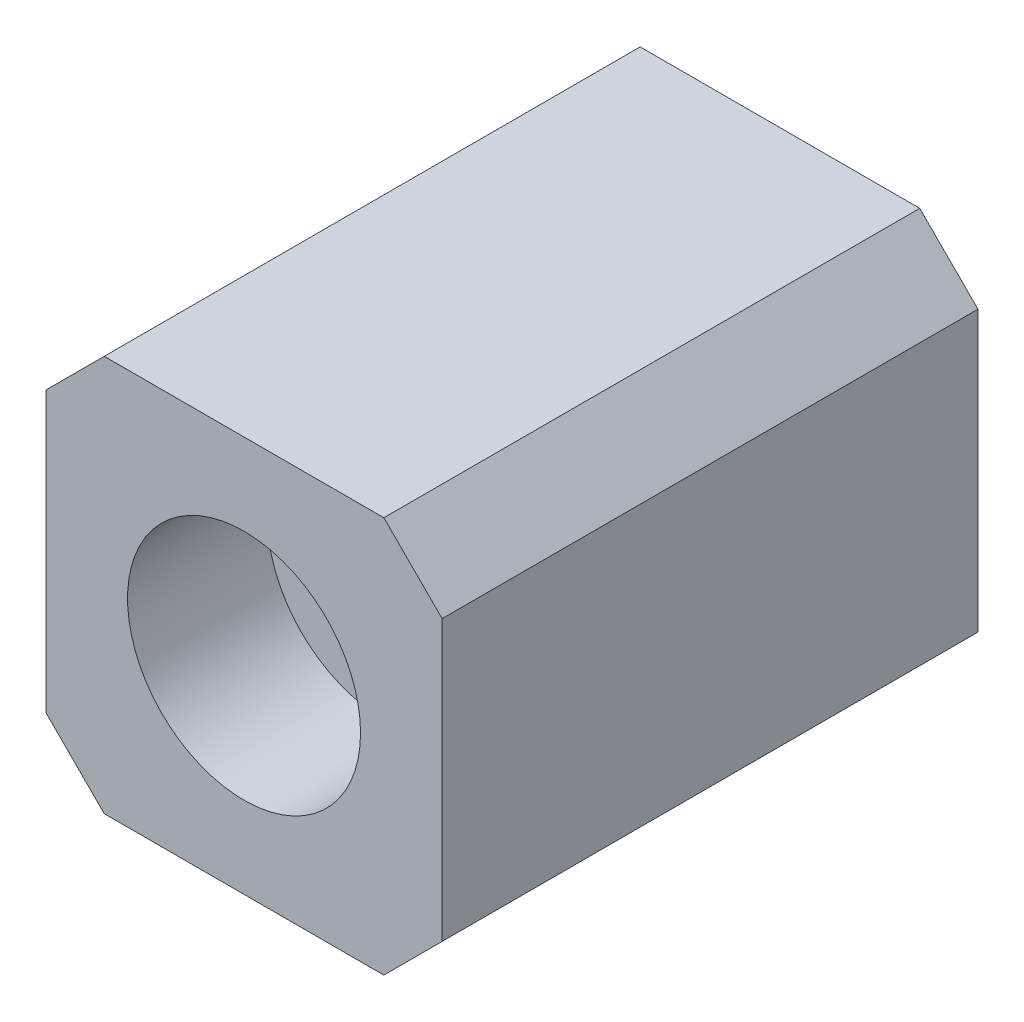
from build123d import *

# Parameters (mm, degrees)
SKETCH3_W           = 17
SKETCH3_H           = 17
BOSS_EXTRUDE1_DEPTH = 23
CUT_EXTRUDE1_DEPTH  = 34.271609519
SKETCH5_R           = 5
CUT_EXTRUDE2_DEPTH  = 6
CUT_EXTRUDE3_DEPTH  = 6


with BuildPart() as part:
    # Sketch3 → Boss-Extrude1 (new body)
    with BuildSketch(Plane.XY):
        with Locations((8.5, -8.5)):
            Rectangle(SKETCH3_W, SKETCH3_H)
    extrude(amount=BOSS_EXTRUDE1_DEPTH)

    # Sketch4 → Cut-Extrude1 (cut, through all)
    with BuildSketch(Plane.XY.offset(23)):
        Polygon((17, 0), (14.5, 0), (17, -2.5), align=None)
        Polygon((0, -2.5), (2.5, 0), (0, 0), align=None)
        Polygon((2.5, -17), (0, -14.5), (0, -17), align=None)
        Polygon((17, -17), (17, -14.5), (14.5, -17), align=None)
    extrude(amount=-CUT_EXTRUDE1_DEPTH, mode=Mode.SUBTRACT)

    # Sketch5 → Cut-Extrude2 (cut)
    with BuildSketch(Plane.XY.offset(23)):
        with Locations((8.5, -8.5)):
            Circle(SKETCH5_R)
    extrude(amount=-CUT_EXTRUDE2_DEPTH, mode=Mode.SUBTRACT)

    # Sketch6 → Cut-Extrude3 (cut)
    with BuildSketch(Plane(origin=(0, 0, 0), x_dir=(-1, 0, 0), z_dir=(0, 0, -1))):
        with BuildLine():
            Line((-10.55, -6.983424911), (-10.55, -10.016575089))
            ThreePointArc((-10.55, -10.016575089), (-5.95, -8.5), (-10.55, -6.983424911))
        make_face()
    extrude(amount=-CUT_EXTRUDE3_DEPTH, mode=Mode.SUBTRACT)


solid = part.part
